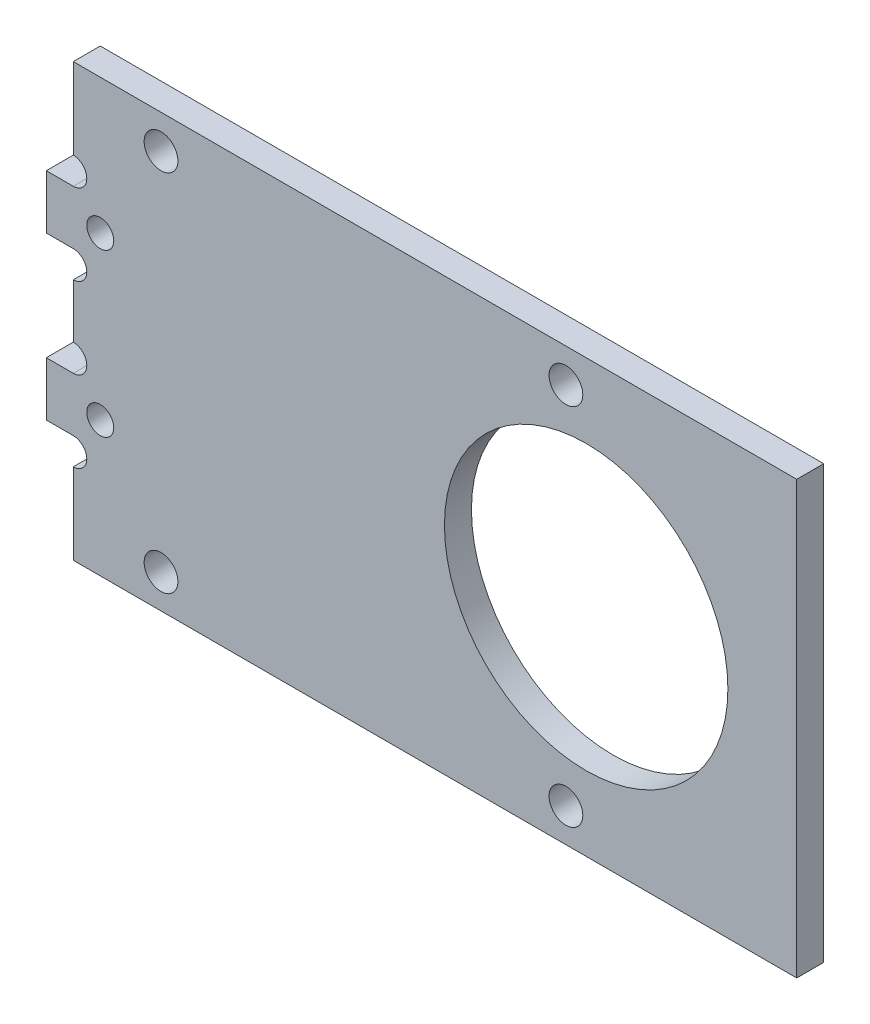
from build123d import *

# Parameters (mm, degrees)
SKETCH_1_R      = 1
SKETCH_1_R_2    = 1.25
SKETCH_1_R_3    = 10.5
EXTRUDE_1_DEPTH = 2


with BuildPart() as part:
    # 草圖1 → 填料-伸長1 (new body)
    with BuildSketch(Plane.XY):
        with BuildLine():
            Line((-8.868434636, 14.893709246), (-8.868434636, 15.893709246))
            Line((-8.868434636, 15.893709246), (-7.868434636, 15.893709246))
            Line((-7.868434636, 15.893709246), (43.781565364, 15.893709246))
            Line((43.781565364, 15.893709246), (44.731565364, 15.893709246))
            Line((44.731565364, 15.893709246), (44.731565364, 14.893709246))
            Line((44.731565364, 14.893709246), (44.731565364, -15.106290754))
            Line((44.731565364, -15.106290754), (44.731565364, -16.106290754))
            Line((44.731565364, -16.106290754), (43.781565364, -16.106290754))
            Line((43.781565364, -16.106290754), (-7.868434636, -16.106290754))
            Line((-7.868434636, -16.106290754), (-8.868434636, -16.106290754))
            Line((-8.868434636, -16.106290754), (-8.868434636, -15.106290754))
            Line((-8.868434636, -15.106290754), (-8.868434636, -10.106290754))
            ThreePointArc((-8.868434636, -10.106290754), (-7.868434636, -9.106290754), (-8.868434636, -8.106290754))
            Line((-8.868434636, -8.106290754), (-10.868434636, -8.106290754))
            Line((-10.868434636, -8.106290754), (-10.868434636, -4.106290754))
            Line((-10.868434636, -4.106290754), (-8.868434636, -4.106290754))
            ThreePointArc((-8.868434636, -4.106290754), (-7.868434636, -3.106290754), (-8.868434636, -2.106290754))
            Line((-8.868434636, -2.106290754), (-8.868434636, 1.893709246))
            ThreePointArc((-8.868434636, 1.893709246), (-7.868434636, 2.893709246), (-8.868434636, 3.893709246))
            Line((-8.868434636, 3.893709246), (-10.868434636, 3.893709246))
            Line((-10.868434636, 3.893709246), (-10.868434636, 7.893709246))
            Line((-10.868434636, 7.893709246), (-8.868434636, 7.893709246))
            ThreePointArc((-8.868434636, 7.893709246), (-7.868434636, 8.893709246), (-8.868434636, 9.893709246))
            Line((-8.868434636, 9.893709246), (-8.868434636, 14.893709246))
        make_face()
        with Locations((-6.868434636, 5.893709246)):
            Circle(SKETCH_1_R, mode=Mode.SUBTRACT)
        with Locations((-6.868434636, -6.106290754)):
            Circle(SKETCH_1_R, mode=Mode.SUBTRACT)
        with Locations((-2.368434636, 13.393709246)):
            Circle(SKETCH_1_R_2, mode=Mode.SUBTRACT)
        with Locations((-2.368434636, -13.606290754)):
            Circle(SKETCH_1_R_2, mode=Mode.SUBTRACT)
        with Locations((27.631565364, 13.393709246)):
            Circle(SKETCH_1_R_2, mode=Mode.SUBTRACT)
        with Locations((27.631565364, -13.606290754)):
            Circle(SKETCH_1_R_2, mode=Mode.SUBTRACT)
        with Locations((29.131565364, -0.106290754)):
            Circle(SKETCH_1_R_3, mode=Mode.SUBTRACT)
    extrude(amount=EXTRUDE_1_DEPTH)


solid = part.part
